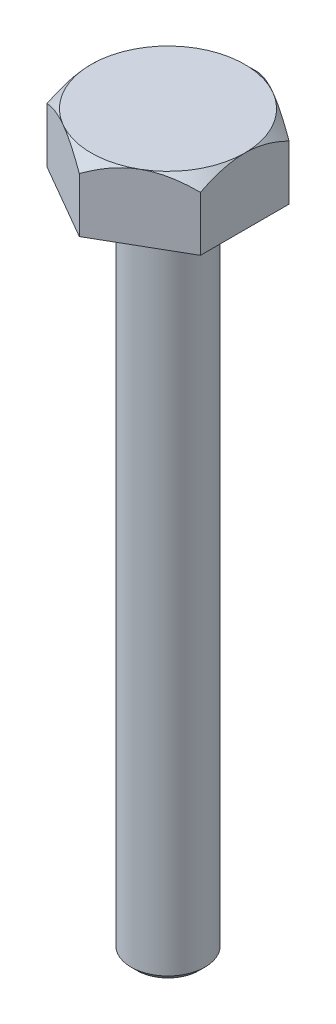
from build123d import *

# Parameters (mm, degrees)
BOSS_EXTRUDE2_DEPTH = 11.43
SKETCH7_OUTSIDE_W   = 59.664
SKETCH7_OUTSIDE_H   = 63.75
SKETCH7_OUTSIDE_R   = 13.208
CUT_EXTRUDE1_DEPTH  = 11.43
CUT_EXTRUDE1_DRAFT  = -45
SKETCH9_R           = 6.35
BOSS_EXTRUDE6_DEPTH = 114.3
CHAMFER3_SIZE       = 1.016


with BuildPart() as part:
    # Sketch5 → Boss-Extrude2 (new body)
    with BuildSketch(Plane(origin=(0, 0, 0), x_dir=(1, 0, 0), z_dir=(0, 1, 0))):
        Polygon((13.208, -7.625642355), (13.208, 7.625642355), (0, 15.251284711), (-13.208, 7.625642355), (-13.208, -7.625642355), (0, -15.251284711), align=None)
    extrude(amount=BOSS_EXTRUDE2_DEPTH)


with BuildPart() as cut_extrude1_tool:
    # Sketch7 outside → Cut-Extrude1 (with draft: the straight prism first)
    with BuildSketch(Plane(origin=(0, 11.43, 0), x_dir=(1, 0, 0), z_dir=(0, 1, 0))):
        Rectangle(SKETCH7_OUTSIDE_W, SKETCH7_OUTSIDE_H)
        Circle(SKETCH7_OUTSIDE_R, mode=Mode.SUBTRACT)
    extrude(amount=-CUT_EXTRUDE1_DEPTH)
    # Cut-Extrude1: the draft: its side faces are tilted about the plane it starts from
    cut_extrude1_sides = [cut_extrude1_tool.faces().sort_by_distance(p)[0] for p in [
        (0, 5.715, 31.875),
        (29.832, 5.715, 0),
        (0, 5.715, -31.875),
        (-29.832, 5.715, 0),
        (-13.208, 5.715, 0),
    ]]
    draft(cut_extrude1_sides, Plane(origin=(0, 11.43, 0), x_dir=(1, 0, 0), z_dir=(0, 1, 0)), CUT_EXTRUDE1_DRAFT)


with BuildPart() as part_1:
    add(part.part)

    # Cut-Extrude1: cut by cut_extrude1_tool
    add(cut_extrude1_tool.part, mode=Mode.SUBTRACT)

    # Sketch9 → Boss-Extrude6 (add)
    with BuildSketch(Plane(origin=(0, 0, 0), x_dir=(-1, 0, 0), z_dir=(0, -1, 0))):
        with Locations(Location((0, 0, 0), (0, 0, 90))):
            Circle(SKETCH9_R)
    extrude(amount=BOSS_EXTRUDE6_DEPTH)

    # Chamfer3
    chamfer3_edges = [part_1.edges().sort_by_distance(p)[0] for p in [
        (0, -114.3, 6.35),
    ]]
    chamfer(chamfer3_edges, length=CHAMFER3_SIZE)


solid = part_1.part
